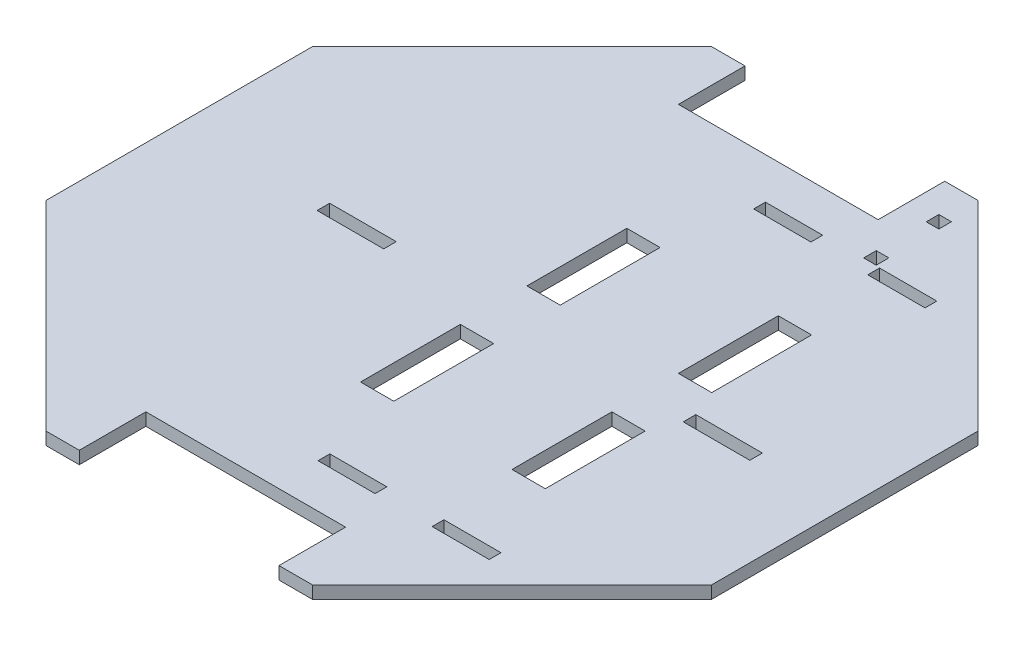
from build123d import *

# Parameters (mm, degrees)
SKETCH1_W           = 254
SKETCH1_H           = 254
BOSS_EXTRUDE1_DEPTH = 4.800000052
CUT_EXTRUDE2_DEPTH  = 360.242313767
CUT_EXTRUDE3_DEPTH  = 4.826
CUT_EXTRUDE5_DEPTH  = 4.826
CUT_EXTRUDE6_DEPTH  = 4.826
SKETCH12_W          = 25.4
SKETCH12_H          = 4.800000052
CUT_EXTRUDE7_DEPTH  = 360.242313767
SKETCH13_W          = 25.4
SKETCH13_H          = 4.800000052
CUT_EXTRUDE8_DEPTH  = 360.242313767
SKETCH18_W          = 76.2
SKETCH18_H          = 25.4
CUT_EXTRUDE15_DEPTH = 360.242313767
SKETCH20_W          = 21.844
SKETCH20_H          = 4.500000144
SKETCH20_W_2        = 21.7714322
CUT_EXTRUDE17_DEPTH = 360.242313767
SKETCH21_W          = 38.1
SKETCH21_H          = 12.7
CUT_EXTRUDE18_DEPTH = 1021.92928265
SKETCH22_W          = 4.800000052
SKETCH22_H          = 4.826
CUT_EXTRUDE19_DEPTH = 360.242313767
SKETCH23_W          = 12.7
SKETCH23_H          = 38.1
CUT_EXTRUDE20_DEPTH = 360.242313767


with BuildPart() as part:
    # Sketch1 → Boss-Extrude1 (new body)
    with BuildSketch(Plane(origin=(0, 0, 0), x_dir=(1, 0, 0), z_dir=(0, 1, 0))):
        with Locations((127, 127)):
            Rectangle(SKETCH1_W, SKETCH1_H)
    extrude(amount=BOSS_EXTRUDE1_DEPTH)

    # Sketch4 → Cut-Extrude2 (cut, through all)
    with BuildSketch(Plane(origin=(0, 4.800000052, 0), x_dir=(1, 0, 0), z_dir=(0, 1, 0))):
        Polygon((76.2, 254), (0, 177.8), (0, 254), align=None)
    extrude(amount=-CUT_EXTRUDE2_DEPTH, mode=Mode.SUBTRACT)

    # Sketch5 → Cut-Extrude3 (cut)
    with BuildSketch(Plane(origin=(0, 4.800000052, 0), x_dir=(1, 0, 0), z_dir=(0, 1, 0))):
        Polygon((177.8, 254), (254, 177.8), (254, 254), align=None)
    extrude(amount=-CUT_EXTRUDE3_DEPTH, mode=Mode.SUBTRACT)

    # Sketch9 → Cut-Extrude5 (cut)
    with BuildSketch(Plane(origin=(0, 4.800000052, 0), x_dir=(1, 0, 0), z_dir=(0, 1, 0))):
        Polygon((0, 76.2), (0, 0), (76.2, 0), align=None)
    extrude(amount=-CUT_EXTRUDE5_DEPTH, mode=Mode.SUBTRACT)

    # Sketch11 → Cut-Extrude6 (cut)
    with BuildSketch(Plane(origin=(0, 4.800000052, 0), x_dir=(1, 0, 0), z_dir=(0, 1, 0))):
        Polygon((254, 76.2), (254, 0), (177.8, 0), align=None)
    extrude(amount=-CUT_EXTRUDE6_DEPTH, mode=Mode.SUBTRACT)

    # Sketch12 → Cut-Extrude7 (cut, through all)
    with BuildSketch(Plane(origin=(0, 4.800000052, 0), x_dir=(1, 0, 0), z_dir=(0, 1, 0))):
        with Locations((207.433333333, 127)):
            Rectangle(SKETCH12_W, SKETCH12_H)
    extrude(amount=-CUT_EXTRUDE7_DEPTH, mode=Mode.SUBTRACT)

    # Sketch13 → Cut-Extrude8 (cut, through all)
    with BuildSketch(Plane(origin=(0, 4.800000052, 0), x_dir=(1, 0, 0), z_dir=(0, 1, 0))):
        with Locations((67.733333333, 127)):
            Rectangle(SKETCH13_W, SKETCH13_H)
    extrude(amount=-CUT_EXTRUDE8_DEPTH, mode=Mode.SUBTRACT)

    # Sketch18 → Cut-Extrude15 (cut, through all)
    with BuildSketch(Plane(origin=(0, 4.800000052, 0), x_dir=(1, 0, 0), z_dir=(0, 1, 0))):
        with Locations((126.999999915, 12.7)):
            Rectangle(SKETCH18_W, SKETCH18_H)
    cut_extrude15 = extrude(amount=-CUT_EXTRUDE15_DEPTH, mode=Mode.SUBTRACT)

    # Mirror1: Cut-Extrude15 across plane
    add(cut_extrude15.mirror(Plane.XY.offset(-127)), mode=Mode.SUBTRACT)

    # Sketch20 → Cut-Extrude17 (cut, through all)
    with BuildSketch(Plane.XZ):
        with Locations((148.735144067, -210.635103476)):
            Rectangle(SKETCH20_W, SKETCH20_H)
        with Locations((192.27800121, -210.635103476)):
            Rectangle(SKETCH20_W, SKETCH20_H)
        with Locations((148.771427967, -44.349999946)):
            Rectangle(SKETCH20_W_2, SKETCH20_H)
        with Locations((192.31428511, -44.349999946)):
            Rectangle(SKETCH20_W_2, SKETCH20_H)
    extrude(amount=-CUT_EXTRUDE17_DEPTH, mode=Mode.SUBTRACT)

    # Sketch21 → Cut-Extrude18 (cut, through all)
    with BuildSketch(Plane(origin=(-734.816241862, 4.800000052, 0), x_dir=(0, 0, -1), z_dir=(0, 1, 0))):
        with Locations((95.25, -918.966241862)):
            Rectangle(SKETCH21_W, SKETCH21_H)
        with Locations((158.75, -918.966241862)):
            Rectangle(SKETCH21_W, SKETCH21_H)
    extrude(amount=-CUT_EXTRUDE18_DEPTH, mode=Mode.SUBTRACT)

    # Sketch22 → Cut-Extrude19 (cut, through all)
    with BuildSketch(Plane.XZ):
        with Locations((177.379999993, -239.474103456)):
            Rectangle(SKETCH22_W, SKETCH22_H)
        with Locations((177.379999993, -215.598103456)):
            Rectangle(SKETCH22_W, SKETCH22_H)
    extrude(amount=-CUT_EXTRUDE19_DEPTH, mode=Mode.SUBTRACT)

    # Sketch23 → Cut-Extrude20 (cut, through all)
    with BuildSketch(Plane(origin=(0, 4.800000052, 0), x_dir=(1, 0, 0), z_dir=(0, 1, 0))):
        with Locations((126.35, 158.75)):
            Rectangle(SKETCH23_W, SKETCH23_H)
        with Locations((126.35, 95.25)):
            Rectangle(SKETCH23_W, SKETCH23_H)
    extrude(amount=-CUT_EXTRUDE20_DEPTH, mode=Mode.SUBTRACT)


solid = part.part
